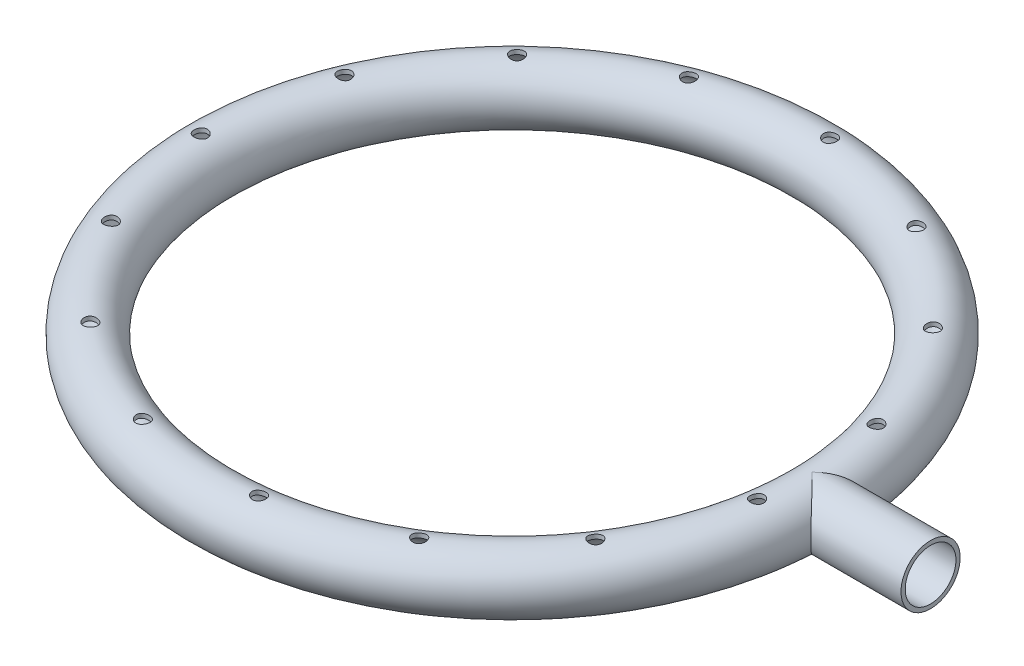
from build123d import *
from build123d.topology import SkipClean

# Parameters (mm, degrees)
SKETCH1_R               = 17.5
SKETCH1_R_2             = 15
SKETCH3_R               = 17.5
BOSS_EXTRUDE1_DEPTH     = 70
SKETCH4_R               = 15
CUT_EXTRUDE1_DEPTH      = 70
CUT_EXTRUDE2_DEPTH      = 30
CUT_EXTRUDE2_DEPTH_BACK = 20
SKETCH5_R               = 15
SKETCH6_R               = 4
CUT_EXTRUDE3_DEPTH      = 421.817656613


with BuildPart() as part:
    # Sketch1 → Revolve1 (revolve)
    with BuildSketch(Plane.XY, mode=Mode.PRIVATE) as revolve1_sk:
        Circle(SKETCH1_R)
        Circle(SKETCH1_R_2, mode=Mode.SUBTRACT)
    revolve(revolve1_sk.sketch.rotate(Axis((-177.5, 0, 0), (0, 1, 0)), 90), axis=Axis((-177.5, 0, 0), (0, 1, 0)))

    # Sketch3 → Boss-Extrude1 (add)
    with BuildSketch(Plane(origin=(0, 0, 0), x_dir=(0, 0, -1), z_dir=(1, 0, 0))):
        with Locations(Location((0, 0, 0), (0, 0, 90))):
            Circle(SKETCH3_R)
    extrude(amount=BOSS_EXTRUDE1_DEPTH)

    # Sketch4 → Cut-Extrude1 (cut)
    with BuildSketch(Plane(origin=(70, 0, 0), x_dir=(0, 0, -1), z_dir=(1, 0, 0))):
        Circle(SKETCH4_R)
    extrude(amount=-CUT_EXTRUDE1_DEPTH, mode=Mode.SUBTRACT)

    # Sketch5 → Cut-Extrude2 (cut, two sides: drawn at the far end of the back side and taken through both)
    with BuildSketch(Plane.XY.offset(-CUT_EXTRUDE2_DEPTH_BACK)):
        Circle(SKETCH5_R)
    extrude(amount=CUT_EXTRUDE2_DEPTH + CUT_EXTRUDE2_DEPTH_BACK, mode=Mode.SUBTRACT)

    # Sketch6 → Cut-Extrude3 (cut, through all)
    with SkipClean():  # the faces are left unmerged after this step: merging them gives an invalid solid
        with BuildSketch(Plane(origin=(0, 0, 0), x_dir=(1, 0, 0), z_dir=(0, 1, 0))):
            with Locations(Location((-2.870376515, -29.75482936, 0), (0, 0, 61.625257913))):
                Circle(SKETCH6_R)
            with Locations(Location((-30.070280105, -98.210656043, 0), (0, 0, 135.310460802))):
                Circle(SKETCH6_R)
            with Locations(Location((-82.762121621, -149.68496808, 0), (0, 0, 123.642183513))):
                Circle(SKETCH6_R)
            with Locations(Location((-151.835002976, -175.27738929, 0), (0, 0, 133.36937107))):
                Circle(SKETCH6_R)
            with Locations(Location((-225.345595475, -170.562757548, 0), (0, 0, 133.625439381))):
                Circle(SKETCH6_R)
            with Locations(Location((-290.583249854, -136.356275511, 0), (0, 0, 134.188279334))):
                Circle(SKETCH6_R)
            with Locations(Location((-336.267783003, -78.572554681, 0), (0, 0, 123.824513525))):
                Circle(SKETCH6_R)
            with Locations(Location((-354.499924111, -7.202925337, 0), (0, 0, 147.40370204))):
                Circle(SKETCH6_R)
            with Locations(Location((-342.127170347, 65.412155234, 0), (0, 0, 135.930774769))):
                Circle(SKETCH6_R)
            with Locations(Location((-301.288883238, 126.716879915, 0), (0, 0, 145.844259084))):
                Circle(SKETCH6_R)
            with Locations(Location((-239.046373631, 166.111104871, 0), (0, 0, 134.332738234))):
                Circle(SKETCH6_R)
            with Locations(Location((-166.161936892, 176.783210723, 0), (0, 0, 133.207596161))):
                Circle(SKETCH6_R)
            with Locations(Location((-95.237954268, 156.887893417, 0), (0, 0, 122.389783454))):
                Circle(SKETCH6_R)
            with Locations(Location((-38.537826677, 109.865234056, 0), (0, 0, 147.52432536))):
                Circle(SKETCH6_R)
            with Locations(Location((-5.865521286, 43.845877633, 0), (0, 0, 124.953307664))):
                Circle(SKETCH6_R)
        extrude(amount=CUT_EXTRUDE3_DEPTH, mode=Mode.SUBTRACT)


solid = part.part
